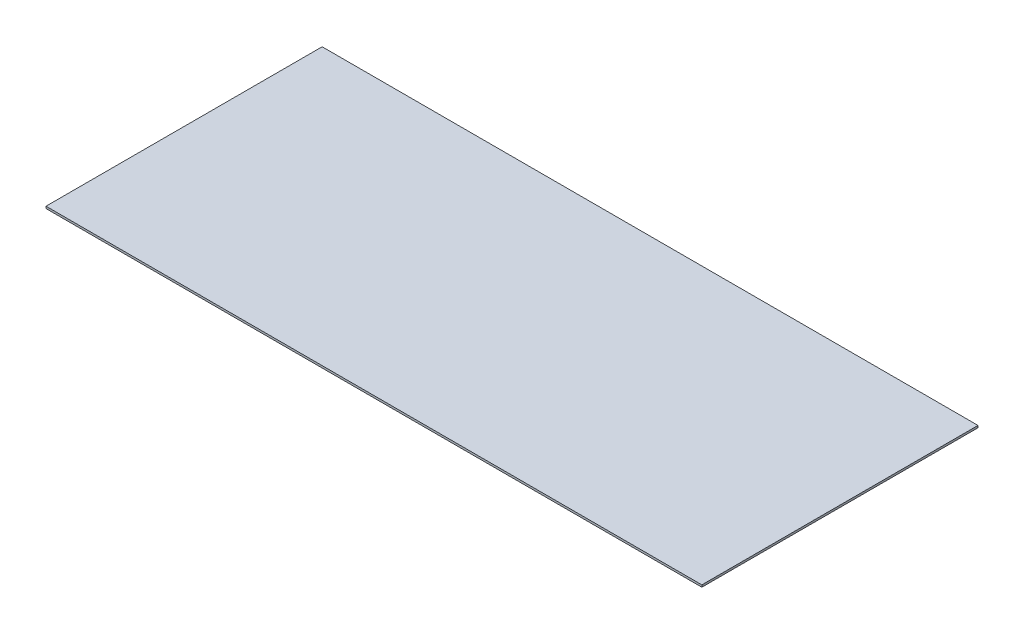
from build123d import *

# Parameters (mm, degrees)
SKETCH_1_W      = 1900
SKETCH_1_H      = 800
EXTRUDE_1_DEPTH = 6


with BuildPart() as part:
    # Эскиз1 → Бобышка-Вытянуть1 (new body)
    with BuildSketch(Plane(origin=(0, 0, 0), x_dir=(1, 0, 0), z_dir=(0, 1, 0))):
        Rectangle(SKETCH_1_W, SKETCH_1_H)
    extrude(amount=EXTRUDE_1_DEPTH)


solid = part.part
